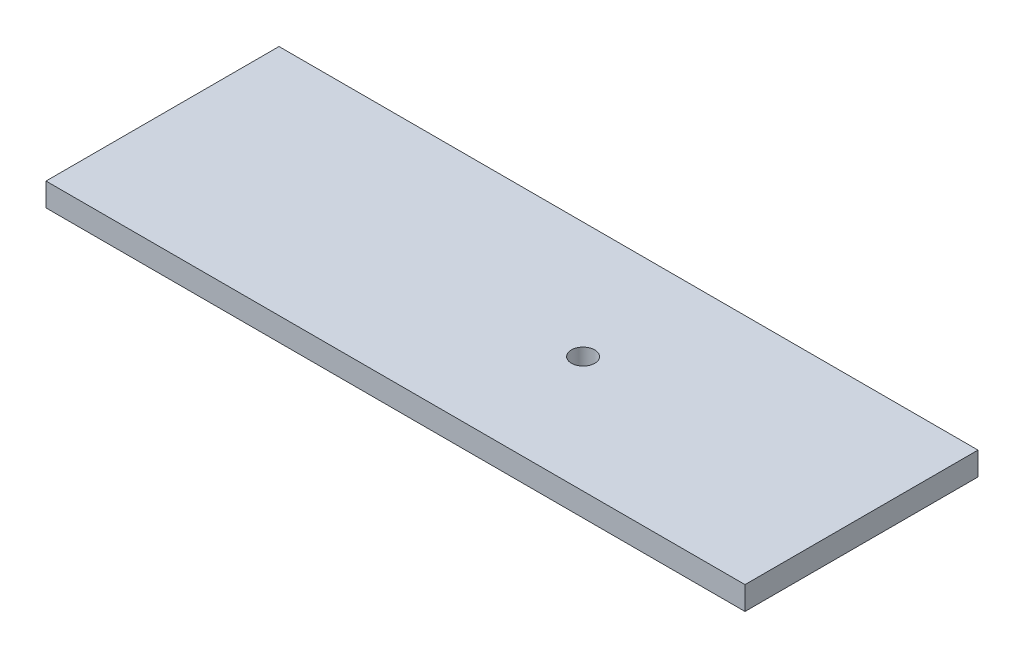
from build123d import *

# Parameters (mm, degrees)
CROQUIS1_W              = 300
CROQUIS1_H              = 100
SALIENTE_EXTRUIR1_DEPTH = 10
CROQUIS2_R              = 5
CORTAR_EXTRUIR1_DEPTH   = 10


with BuildPart() as part:
    # Croquis1 → Saliente-Extruir1 (new body)
    with BuildSketch(Plane(origin=(0, 0, 0), x_dir=(1, 0, 0), z_dir=(0, 1, 0))):
        with Locations((150, 50)):
            Rectangle(CROQUIS1_W, CROQUIS1_H)
    extrude(amount=SALIENTE_EXTRUIR1_DEPTH)

    # Croquis2 → Cortar-Extruir1 (cut)
    with BuildSketch(Plane(origin=(0, 10, 0), x_dir=(1, 0, 0), z_dir=(0, 1, 0))):
        with Locations(Location((180.5, 50, 0), (0, 0, 270))):
            Circle(CROQUIS2_R)
    extrude(amount=-CORTAR_EXTRUIR1_DEPTH, mode=Mode.SUBTRACT)


solid = part.part
